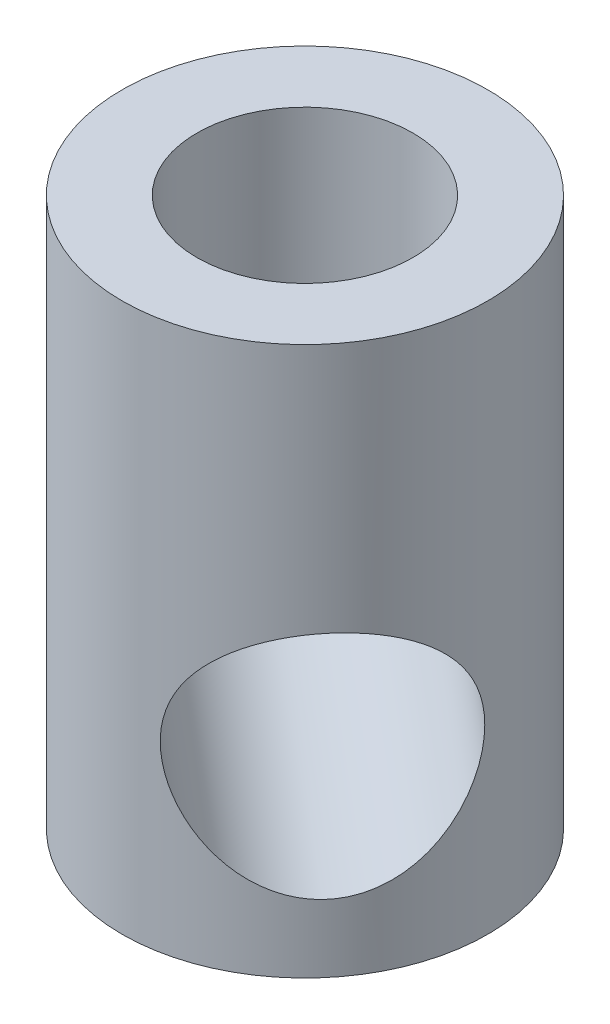
from build123d import *

# Parameters (mm, degrees)
SKETCH1_R                    = 25.4
BOSS_EXTRUDE1_DEPTH          = 76.2
SKETCH2_R                    = 15
CUT_EXTRUDE1_DEPTH           = 25.4
F_12_8_12_8_DIAMETER_HOLE1_D = 32


with BuildPart() as part:
    # Sketch1 → Boss-Extrude1 (new body)
    with BuildSketch(Plane(origin=(0, 0, 0), x_dir=(1, 0, 0), z_dir=(0, 1, 0))):
        with Locations(Location((0, 0, 0), (0, 0, 90))):
            Circle(SKETCH1_R)
    extrude(amount=BOSS_EXTRUDE1_DEPTH)

    # Sketch2 → Cut-Extrude1 (cut)
    with BuildSketch(Plane(origin=(0, 76.2, 0), x_dir=(1, 0, 0), z_dir=(0, 1, 0))):
        with Locations(Location((0, 0, 0), (0, 0, 270))):
            Circle(SKETCH2_R)
    extrude(amount=-CUT_EXTRUDE1_DEPTH, mode=Mode.SUBTRACT)

    # Ø12.8 (12.8) Diameter Hole1 (through all)
    with Locations(Plane(origin=(19.461654008, 25.4, 16.321887859), x_dir=(-0.642594010206, 0, 0.766206850692), z_dir=(0.766206850692, 0, 0.642594010206))):
        with Locations((0, 0)):
            Hole(F_12_8_12_8_DIAMETER_HOLE1_D / 2)


solid = part.part
